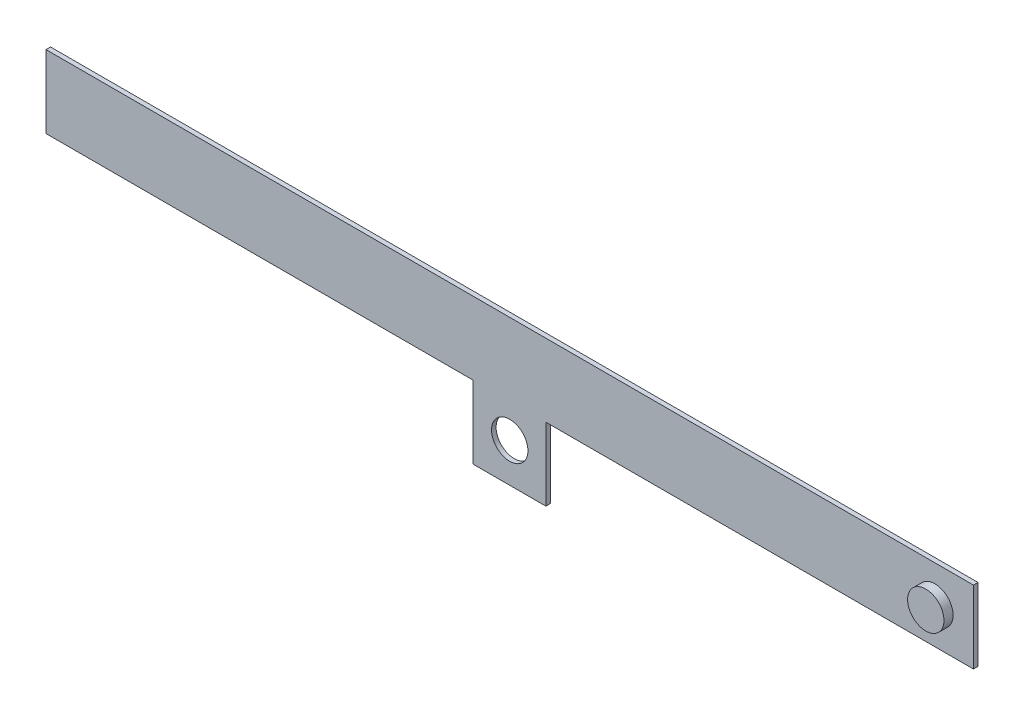
from build123d import *

# Parameters (mm, degrees)
SKETCH1_R           = 12.7
BOSS_EXTRUDE1_DEPTH = 3.175
SKETCH2_R           = 12.7
BOSS_EXTRUDE2_DEPTH = 6.35


with BuildPart() as part:
    # Sketch1 → Boss-Extrude1 (new body)
    with BuildSketch(Plane.XY):
        Polygon((-323.85, -25.4), (-25.546675569, -25.4), (-25.546675569, -76.2), (25.253324431, -76.2), (25.253324431, -25.4), (323.85, -25.4), (323.85, 25.4), (-323.85, 25.4), align=None)
        with Locations((0, -48.981872029)):
            Circle(SKETCH1_R, mode=Mode.SUBTRACT)
    extrude(amount=BOSS_EXTRUDE1_DEPTH)

    # Sketch2 → Boss-Extrude2 (add)
    with BuildSketch(Plane.XY.offset(3.175)):
        with Locations(Location((296.914396716, 0, 0), (0, 0, 180))):
            Circle(SKETCH2_R)
    extrude(amount=BOSS_EXTRUDE2_DEPTH)


solid = part.part
